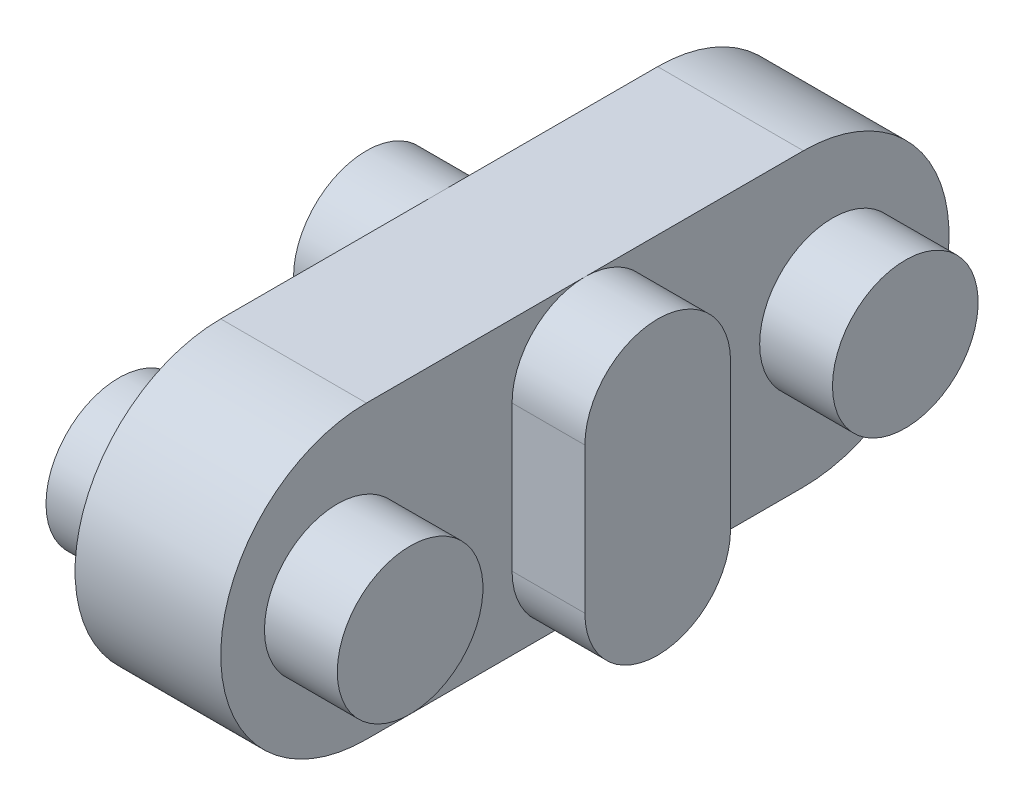
from build123d import *

# Parameters (mm, degrees)
BOSS_EXTRUDE1_DEPTH = 5.002296298
BOSS_EXTRUDE2_REACH = 29.951
BOSS_EXTRUDE3_REACH = 30.724
SKETCH4_W           = 2.497703702
SKETCH4_H           = 2.5
SKETCH5_W           = 2.5
SKETCH5_H           = 2.5
SKETCH6_W           = 2.5
SKETCH6_H           = 2.5
SKETCH7_W           = 2.497703702
SKETCH7_H           = 2.5


with BuildPart() as part:
    # Sketch1 → Boss-Extrude1 (new body)
    with BuildSketch(Plane(origin=(5.002296298, 0, 0), x_dir=(0, 0, -1), z_dir=(1, 0, 0))):
        with BuildLine():
            Line((-5, 0), (-20, 0))
            ThreePointArc((-20, 0), (-25, -5), (-20, -10))
            Line((-20, -10), (-5, -10))
            ThreePointArc((-5, -10), (0, -5), (-5, 0))
        make_face()
    extrude(amount=-BOSS_EXTRUDE1_DEPTH)

    # Sketch2 → Boss-Extrude2 (add, up to next)
    with BuildSketch(Plane(origin=(7.502296298, 0, 0), x_dir=(0, 0, -1), z_dir=(1, 0, 0)), mode=Mode.PRIVATE) as boss_extrude2_sk1:
        with BuildLine():
            Line((-15, -2.5), (-15, -7.5))
            ThreePointArc((-15, -7.5), (-12.5, -10), (-10, -7.5))
            Line((-10, -7.5), (-10, -2.5))
            ThreePointArc((-10, -2.5), (-12.5, 0), (-15, -2.5))
        make_face()
    boss_extrude2_tool1 = extrude(boss_extrude2_sk1.sketch, amount=-BOSS_EXTRUDE2_REACH, mode=Mode.PRIVATE) - part.part
    add(boss_extrude2_tool1.solids().sort_by_distance((7.502296, -5, 12.5))[0])

    # Sketch3 → Boss-Extrude3 (add, up to next)
    with BuildSketch(Plane(origin=(-2.5, 0, 0), x_dir=(0, -1, 0), z_dir=(-1, 0, 0)), mode=Mode.PRIVATE) as boss_extrude3_sk1:
        with BuildLine():
            Line((7.5, 15), (2.5, 15))
            ThreePointArc((2.5, 15), (0, 12.5), (2.5, 10))
            Line((2.5, 10), (7.5, 10))
            ThreePointArc((7.5, 10), (10, 12.5), (7.5, 15))
        make_face()
    boss_extrude3_tool1 = extrude(boss_extrude3_sk1.sketch, amount=-BOSS_EXTRUDE3_REACH, mode=Mode.PRIVATE) - part.part
    add(boss_extrude3_tool1.solids().sort_by_distance((-2.5, -5, 12.5))[0])

    # Sketch4 → Revolve1 (revolve)
    with BuildSketch(Plane(origin=(0, 0, 4), x_dir=(-1, 0, 0), z_dir=(0, 0, -1)), mode=Mode.PRIVATE) as revolve1_sk:
        with Locations((1.248851851, -3.75)):
            Rectangle(SKETCH4_W, SKETCH4_H)
    revolve(revolve1_sk.sketch.rotate(Axis((0, -5, 4), (-1, 0, 0)), 270), axis=Axis((0, -5, 4), (-1, 0, 0)))

    # Sketch5 → Revolve2 (revolve)
    with BuildSketch(Plane(origin=(0, 0, 4), x_dir=(-1, 0, 0), z_dir=(0, 0, -1)), mode=Mode.PRIVATE) as revolve2_sk:
        with Locations((-6.252296298, -3.75)):
            Rectangle(SKETCH5_W, SKETCH5_H)
    revolve(revolve2_sk.sketch.rotate(Axis((7.502296298, -5, 4), (-1, 0, 0)), 270), axis=Axis((7.502296298, -5, 4), (-1, 0, 0)))

    # Sketch6 → Revolve3 (revolve)
    with BuildSketch(Plane(origin=(0, 0, 21), x_dir=(-1, 0, 0), z_dir=(0, 0, -1)), mode=Mode.PRIVATE) as revolve3_sk:
        with Locations((-6.252296298, -3.75)):
            Rectangle(SKETCH6_W, SKETCH6_H)
    revolve(revolve3_sk.sketch.rotate(Axis((7.502296298, -5, 21), (-1, 0, 0)), 270), axis=Axis((7.502296298, -5, 21), (-1, 0, 0)))

    # Sketch7 → Revolve4 (revolve)
    with BuildSketch(Plane(origin=(0, 0, 21), x_dir=(-1, 0, 0), z_dir=(0, 0, -1)), mode=Mode.PRIVATE) as revolve4_sk:
        with Locations((1.248851851, -3.75)):
            Rectangle(SKETCH7_W, SKETCH7_H)
    revolve(revolve4_sk.sketch.rotate(Axis((0, -5, 21), (-1, 0, 0)), 270), axis=Axis((0, -5, 21), (-1, 0, 0)))


solid = part.part
